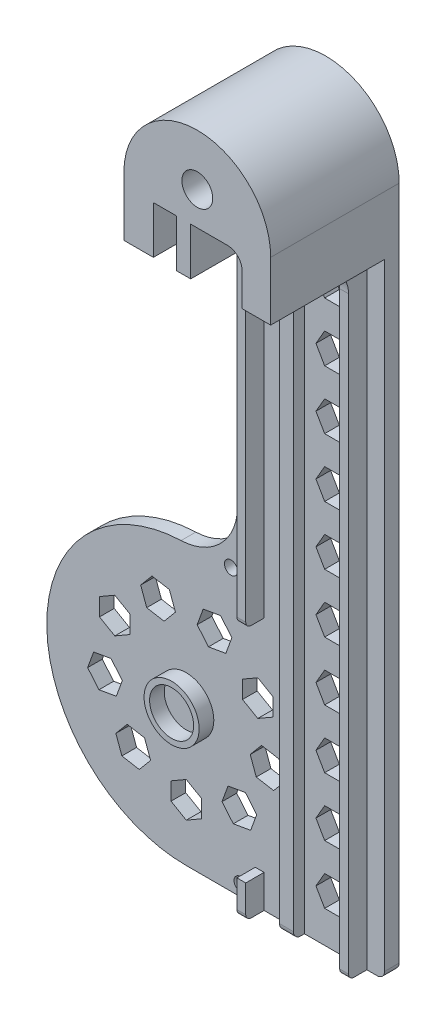
from build123d import *

# Parameters (mm, degrees)
BODYTOP_R                       = 19
BODY_TOP_DEPTH                  = 1
SKIZZE_LAMELLEN_W               = 1.2
SKIZZE_LAMELLEN_H               = 85
LAMMELLEN_DEPTH                 = 2.5
SKIZZE1_W                       = 1.9
SKIZZE1_H                       = 85
FUEHRUNG_DEPTH                  = 1.5
VERRUNDUNG6_R                   = 1
SPARUNG_W                       = 1.2
SPARUNG_H                       = 30
AUSSPARUNG_DEPTH                = 2.5
ANBAUPLATTE_DEPTH               = 1
ANBAUSTUTZEN_START              = 15.5
ANBAUSTUTZEN_DEPTH              = 15.5
SKIZZEDRUCKERZAHNRAD_R          = 3.75
SKIZZEDRUCKERZAHNRAD_R_2        = 3
DRUCKER_ZAHNRAD_DEPTH           = 2
SKIZZEHALTERLOCH_R              = 2.1
HALTERLOCH_DEPTH                = 18.5
VERRUNDUNG24_R                  = 8
SKIZZEBOHRLOCH_R                = 0.9
BOHRLOCH_DEPTH                  = 10
SKIZZE6_W                       = 7.001894066
SKIZZE6_H                       = 6.469061082
SKIZZE6_W_2                     = 3.181141547
SCHNITT_LINEAR_AUSTRAGEN4_DEPTH = 15.5
VERRUNDUNG34_R                  = 1
SCHNITT_LINEAR_AUSTRAGEN5_DEPTH = 90.951375897
LINEARES_MUSTER2_COUNT          = 11
LINEARES_MUSTER2_PITCH          = 8
SCHNITT_LINEAR_AUSTRAGEN6_DEPTH = 90.58375983
KREISMUSTER1_COUNT              = 9
VERRUNDUNG35_R                  = 2
VERRUNDUNG36_R                  = 4
VERRUNDUNG37_R                  = 4
VERRUNDUNG38_R                  = 0.75


with BuildPart() as part:
    # BodyTop → body-top (new, symmetric)
    with BuildSketch(Plane.XY):
        Circle(BODYTOP_R)
        with BuildLine():
            ThreePointArc((19, 0), (13.435028843, -13.435028843), (0, -19))
            Line((0, -19), (27, -19))
            Line((27, -19), (27, 66))
            Line((27, 66), (7, 66))
            Line((7, 66), (7, 19))
            Line((7, 19), (0, 19))
            ThreePointArc((0, 19), (13.435028843, 13.435028843), (19, 0))
        make_face()
    extrude(amount=BODY_TOP_DEPTH, both=True)

    # skizze_lamellen → Lammellen (add)
    with BuildSketch(Plane.XY.offset(1)):
        with Locations((24, 23.5)):
            Rectangle(SKIZZE_LAMELLEN_W, SKIZZE_LAMELLEN_H)
        with Locations((10, 23.5)):
            Rectangle(SKIZZE_LAMELLEN_W, SKIZZE_LAMELLEN_H)
    extrude(amount=LAMMELLEN_DEPTH)

    # Skizze1 → fuehrung (add)
    with BuildSketch(Plane.XY.offset(1)):
        with Locations((15.15, 23.5)):
            Rectangle(SKIZZE1_W, SKIZZE1_H)
    extrude(amount=FUEHRUNG_DEPTH)

    # Verrundung6
    verrundung6_edges = [part.edges().sort_by_distance(p)[0] for p in [
        (27, -19, 0),
    ]]
    fillet(verrundung6_edges, radius=VERRUNDUNG6_R)

    # sparung → Aussparung (cut)
    with BuildSketch(Plane.XY.offset(3.5)):
        with Locations((10, 0.5)):
            Rectangle(SPARUNG_W, SPARUNG_H)
    extrude(amount=-AUSSPARUNG_DEPTH, mode=Mode.SUBTRACT)

    # SkizzeAnbau → Anbauplatte (add, symmetric)
    with BuildSketch(Plane.XY):
        with BuildLine():
            Line((7, 74), (7, 66))
            Line((7, 66), (27, 66))
            Line((27, 66), (27, 74))
            ThreePointArc((27, 74), (17, 84), (7, 74))
        make_face()
    extrude(amount=ANBAUPLATTE_DEPTH, both=True)

    # SkizzeStutzen → anbaustutzen (add)
    with BuildSketch(Plane.XY.offset(1).offset(ANBAUSTUTZEN_START)):
        with BuildLine():
            Line((7, 66), (27, 66))
            Line((27, 66), (27, 74))
            ThreePointArc((27, 74), (17, 84), (7, 74))
            Line((7, 74), (7, 66))
        make_face()
    extrude(amount=-ANBAUSTUTZEN_DEPTH)

    # Skizzedruckerzahnrad → drucker zahnrad (add)
    with BuildSketch(Plane.XY.offset(1)):
        Circle(SKIZZEDRUCKERZAHNRAD_R)
        Circle(SKIZZEDRUCKERZAHNRAD_R_2, mode=Mode.SUBTRACT)
    extrude(amount=DRUCKER_ZAHNRAD_DEPTH)

    # SkizzeHalterloch → halterloch (cut)
    with BuildSketch(Plane.XY.offset(16.5)):
        with Locations((17, 77)):
            Circle(SKIZZEHALTERLOCH_R)
    extrude(amount=-HALTERLOCH_DEPTH, mode=Mode.SUBTRACT)

    # Verrundung24
    verrundung24_edges = [part.edges().sort_by_distance(p)[0] for p in [
        (7, 19, 0),
    ]]
    fillet(verrundung24_edges, radius=VERRUNDUNG24_R)

    # Skizzebohrloch → bohrloch (cut)
    with BuildSketch(Plane.XY.offset(1)):
        with Locations((7.4, -17.5)):
            Circle(SKIZZEBOHRLOCH_R)
        with Locations((6.1, 19.2)):
            Circle(SKIZZEBOHRLOCH_R)
    extrude(amount=-BOHRLOCH_DEPTH, mode=Mode.SUBTRACT)

    # Skizze6 → Schnitt-Linear austragen4 (cut)
    with BuildSketch(Plane.XY.offset(16.5)):
        with Locations((19.600947033, 69.234530541)):
            Rectangle(SKIZZE6_W, SKIZZE6_H)
        with Locations((12.609429227, 69.234530541)):
            Rectangle(SKIZZE6_W_2, SKIZZE6_H)
    extrude(amount=-SCHNITT_LINEAR_AUSTRAGEN4_DEPTH, mode=Mode.SUBTRACT)

    # Verrundung34
    verrundung34_edges = [part.edges().sort_by_distance(p)[0] for p in [
        (15.15, -19, 2.5),
    ]]
    fillet(verrundung34_edges, radius=VERRUNDUNG34_R)

    # Skizze7 → Schnitt-Linear austragen5 (cut, symmetric)
    with BuildSketch(Plane(origin=(0, 0, -1), x_dir=(-1, 0, 0), z_dir=(0, 0, -1))):
        Polygon((-22.413127148, -12.56760803), (-21.225184268, -14.625185455), (-18.849298507, -14.625185455), (-17.661355626, -12.56760803), (-18.849298507, -10.510030604), (-21.225184268, -10.510030604), align=None)
    schnitt_linear_austragen5 = extrude(amount=SCHNITT_LINEAR_AUSTRAGEN5_DEPTH, both=True, mode=Mode.SUBTRACT)

    # Lineares Muster2: Schnitt-Linear austragen5 ×11
    with Locations(*[(0, i * LINEARES_MUSTER2_PITCH, 0) for i in range(1, LINEARES_MUSTER2_COUNT)]):
        add(schnitt_linear_austragen5, mode=Mode.SUBTRACT)

    # Skizze8 → Schnitt-Linear austragen6 (cut, symmetric)
    with BuildSketch(Plane.XY.offset(1)):
        Polygon((0, -8.844754272), (-2.078547165, -10.044804037), (-2.078547165, -12.444903567), (0, -13.644953333), (2.078547165, -12.444903567), (2.078547165, -10.044804037), align=None)
    schnitt_linear_austragen6 = extrude(amount=SCHNITT_LINEAR_AUSTRAGEN6_DEPTH, both=True, mode=Mode.SUBTRACT)

    # Kreismuster1: Schnitt-Linear austragen6 ×9 about axis
    kreismuster1_axis = Axis((0, 0, 0), (0, 0, 1))
    for i in range(1, KREISMUSTER1_COUNT):
        add(schnitt_linear_austragen6.rotate(kreismuster1_axis, i * 360 / KREISMUSTER1_COUNT), mode=Mode.SUBTRACT)

    # Verrundung35
    verrundung35_edges = [part.edges().sort_by_distance(p)[0] for p in [
        (23.101894066, 72.469061082, 8.75),
    ]]
    fillet(verrundung35_edges, radius=VERRUNDUNG35_R)

    # Verrundung36
    verrundung36_edges = [part.edges().sort_by_distance(p)[0] for p in [
        (10, 66, 3.5),
    ]]
    fillet(verrundung36_edges, radius=VERRUNDUNG36_R)

    # Verrundung37
    verrundung37_edges = [part.edges().sort_by_distance(p)[0] for p in [
        (24, 66, 3.5),
    ]]
    fillet(verrundung37_edges, radius=VERRUNDUNG37_R)

    # Verrundung38
    verrundung38_edges = [part.edges().sort_by_distance(p)[0] for p in [
        (10, 15.5, 3.5),
        (10, -19, 3.5),
        (24, -19, 3.5),
    ]]
    fillet(verrundung38_edges, radius=VERRUNDUNG38_R)


solid = part.part
